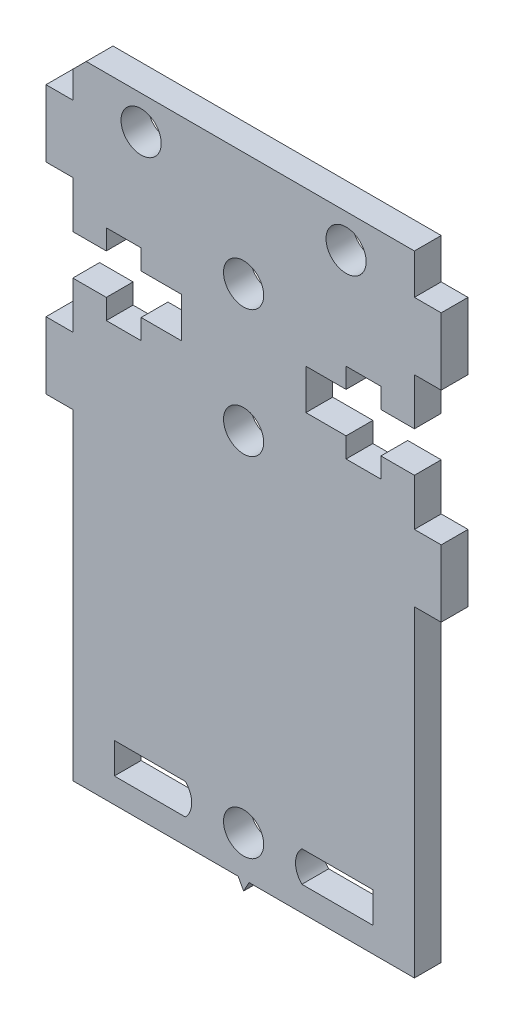
from build123d import *

# Parameters (mm, degrees)
SKETCH_1_R      = 1.5
EXTRUDE_1_DEPTH = 2


with BuildPart() as part:
    # 草图1 → 凸台-拉伸1 (new body)
    with BuildSketch(Plane.XY):
        Polygon((-8.932938962, -10.700971973), (-10.932938962, -10.700971973), (-10.932938962, -5.700971973), (-8.932938962, -5.700971973), (-8.932938962, -2.200971973), (-6.432938962, -2.200971973), (-6.432938962, -3.700971973), (-3.832938962, -3.700971973), (-3.832938962, -2.200971973), (-0.832938962, -2.200971973), (-0.832938962, 0.799028027), (-3.832938962, 0.799028027), (-3.832938962, 2.299028027), (-6.432938962, 2.299028027), (-6.432938962, 0.799028027), (-8.932938962, 0.799028027), (-8.932938962, 4.299028027), (-10.932938962, 4.299028027), (-10.932938962, 9.299028027), (-8.932938962, 9.299028027), (-8.932938962, 11.299028027), (-7.932938962, 12.299028027), (16.567061038, 12.299028027), (16.567061038, 9.299028027), (18.567061038, 9.299028027), (18.567061038, 4.299028027), (16.567061038, 4.299028027), (16.567061038, 0.799028027), (14.067061038, 0.799028027), (14.067061038, 2.299028027), (11.467061038, 2.299028027), (11.467061038, 0.799028027), (8.467061038, 0.799028027), (8.467061038, -2.200971973), (11.467061038, -2.200971973), (11.467061038, -3.700971973), (14.067061038, -3.700971973), (14.067061038, -2.200971973), (16.567061038, -2.200971973), (16.567061038, -5.700971973), (18.567061038, -5.700971973), (18.567061038, -10.700971973), (16.567061038, -10.700971973), (16.567061038, -34.700971973), (4.222987954, -34.700971973), (3.817061038, -35.455763704), (3.411134121, -34.700971973), (-8.932938962, -34.700971973), align=None)
        with Locations((3.817061038, -5.700971973)):
            Circle(SKETCH_1_R, mode=Mode.SUBTRACT)
        with Locations((3.817061038, 3.799028027)):
            Circle(SKETCH_1_R, mode=Mode.SUBTRACT)
        with Locations((3.817061038, -31.692801434)):
            Circle(SKETCH_1_R, mode=Mode.SUBTRACT)
        with Locations((-3.832938962, 9.799028027)):
            Circle(SKETCH_1_R, mode=Mode.SUBTRACT)
        with Locations((11.467061038, 9.799028027)):
            Circle(SKETCH_1_R, mode=Mode.SUBTRACT)
        with BuildLine():
            Line((13.467061038, -32.842801434), (8.167061038, -32.842801434))
            ThreePointArc((8.167061038, -32.842801434), (7.690715441, -31.692801434), (8.167061038, -30.542801434))
            Line((8.167061038, -30.542801434), (13.467061038, -30.542801434))
            Line((13.467061038, -30.542801434), (13.467061038, -32.842801434))
        make_face(mode=Mode.SUBTRACT)
        with BuildLine():
            Line((-5.832938962, -30.542801434), (-0.532938962, -30.542801434))
            ThreePointArc((-0.532938962, -30.542801434), (-0.056593366, -31.692801434), (-0.532938962, -32.842801434))
            Line((-0.532938962, -32.842801434), (-5.832938962, -32.842801434))
            Line((-5.832938962, -32.842801434), (-5.832938962, -30.542801434))
        make_face(mode=Mode.SUBTRACT)
    extrude(amount=EXTRUDE_1_DEPTH)


solid = part.part
